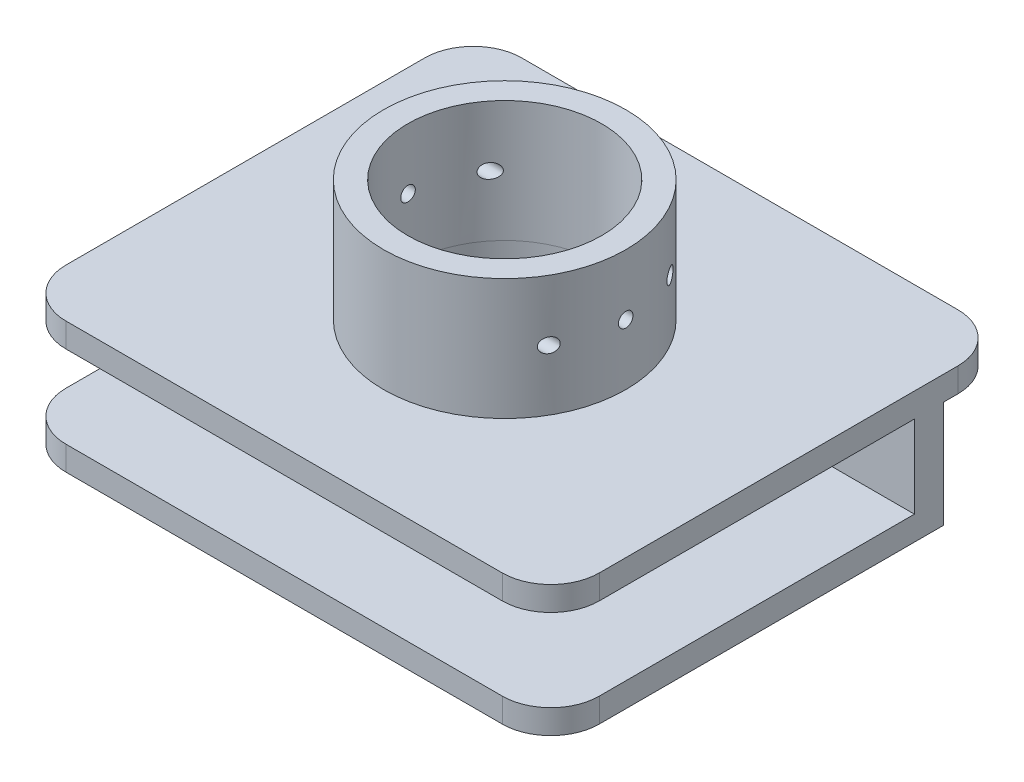
from build123d import *
from build123d.topology import SkipClean

# Parameters (mm, degrees)
IZIM1_W                          = 110
IZIM1_H                          = 5
Y_KSEKLIK_EKSTR_ZYON1_DEPTH      = 80
Y_KSEKLIK_EKSTR_ZYON1_2_DEPTH    = 80
Y_KSEKLIK_EKSTR_ZYON2_DEPTH      = 5
Y_KSEKLIK_EKSTR_ZYON2_DEPTH_BACK = 1
IZIM3_W                          = 110
IZIM3_H                          = 27
RADYUS1_R                        = 10
RADYUS2_R                        = 10
RADYUS3_R                        = 10
RADYUS4_R                        = 10
Y_KSEKLIK_EKSTR_ZYON3_DEPTH      = 25
IZIM5_R                          = 20
KES_EKSTR_ZYON1_DEPTH            = 14
KES_EKSTR_ZYON6_DEPTH            = 32
KES_EKSTR_ZYON7_DEPTH            = 47
KES_EKSTR_ZYON7_DEPTH_BACK       = 50
IZIM7_W                          = 110
IZIM7_H                          = 5
Y_KSEKLIK_EKSTR_ZYON4_DEPTH      = 13
RADYUS5_R                        = 10
RADYUS6_R                        = 10


with BuildPart() as part:
    # Çizim1 → Yükseklik-Ekstrüzyon1 (new body)
    with BuildSketch(Plane.XY):
        with Locations((-3.590869611, -4.330118179)):
            Rectangle(IZIM1_W, IZIM1_H)
    extrude(amount=Y_KSEKLIK_EKSTR_ZYON1_DEPTH)



with BuildPart() as body_2:
    # Çizim1 → Y_kseklik-Ekstr_zyon1 2 (new body)
    with BuildSketch(Plane.XY):
        with Locations((-3.590869611, -26.330118179)):
            Rectangle(IZIM1_W, IZIM1_H)
    extrude(amount=Y_KSEKLIK_EKSTR_ZYON1_2_DEPTH)


with BuildPart() as part_1:
    add(part.part)

    add(body_2.part)  # Yükseklik-Ekstrüzyon2 merges body 2
    # Çizim3 → Yükseklik-Ekstrüzyon2 (add, two sides: drawn at the far end of the back side and taken through both)
    with BuildSketch(Plane.XY.offset(-Y_KSEKLIK_EKSTR_ZYON2_DEPTH_BACK)):
        with Locations((-3.590869611, -15.330118179)):
            Rectangle(IZIM3_W, IZIM3_H)
    extrude(amount=Y_KSEKLIK_EKSTR_ZYON2_DEPTH + Y_KSEKLIK_EKSTR_ZYON2_DEPTH_BACK)

    # Radyus1
    radyus1_edges = [part_1.edges().sort_by_distance(p)[0] for p in [
        (-58.590869611, -4.330118179, 80),
    ]]
    fillet(radyus1_edges, radius=RADYUS1_R)

    # Radyus2
    radyus2_edges = [part_1.edges().sort_by_distance(p)[0] for p in [
        (-58.590869611, -26.330118179, 80),
    ]]
    fillet(radyus2_edges, radius=RADYUS2_R)

    # Radyus3
    radyus3_edges = [part_1.edges().sort_by_distance(p)[0] for p in [
        (51.409130389, -4.330118179, 80),
    ]]
    fillet(radyus3_edges, radius=RADYUS3_R)

    # Radyus4
    radyus4_edges = [part_1.edges().sort_by_distance(p)[0] for p in [
        (51.409130389, -26.330118179, 80),
    ]]
    fillet(radyus4_edges, radius=RADYUS4_R)

    # Çizim4 → Yükseklik-Ekstrüzyon3 (add)
    with BuildSketch(Plane(origin=(0, -1.830118179, 0), x_dir=(1, 0, 0), z_dir=(0, 1, 0))):
        with BuildLine():
            ThreePointArc((17.413740105, -20.942479183), (-3.590869611, -9.5), (-24.595479326, -20.942479183))
            Line((-24.595479326, -20.942479183), (-20.394557383, -23.653983347))
            ThreePointArc((-20.394557383, -23.653983347), (-3.590869611, -14.5), (13.212818162, -23.653983347))
            Line((13.212818162, -23.653983347), (17.413740105, -20.942479183))
        make_face()
        with BuildLine():
            Line((-20.394557383, -23.653983347), (-24.595479326, -20.942479183))
            ThreePointArc((-24.595479326, -20.942479183), (-28.590869611, -34.5), (-24.595479326, -48.057520817))
            Line((-24.595479326, -48.057520817), (-20.394557383, -45.346016653))
            ThreePointArc((-20.394557383, -45.346016653), (-23.590869611, -34.5), (-20.394557383, -23.653983347))
        make_face()
        with BuildLine():
            Line((-20.394557383, -45.346016653), (-24.595479326, -48.057520817))
            ThreePointArc((-24.595479326, -48.057520817), (-3.590869611, -59.5), (17.413740105, -48.057520817))
            Line((17.413740105, -48.057520817), (13.212818162, -45.346016653))
            ThreePointArc((13.212818162, -45.346016653), (-3.590869611, -54.5), (-20.394557383, -45.346016653))
        make_face()
        with BuildLine():
            ThreePointArc((21.409130389, -34.5), (20.389489466, -27.433007814), (17.413740105, -20.942479183))
            Line((17.413740105, -20.942479183), (13.212818162, -23.653983347))
            ThreePointArc((13.212818162, -23.653983347), (15.593417651, -28.846406251), (16.409130389, -34.5))
            ThreePointArc((16.409130389, -34.5), (15.593417651, -40.153593749), (13.212818162, -45.346016653))
            Line((13.212818162, -45.346016653), (17.413740105, -48.057520817))
            ThreePointArc((17.413740105, -48.057520817), (20.389489466, -41.566992186), (21.409130389, -34.5))
        make_face()
        with BuildLine():
            ThreePointArc((17.413740105, -20.942479183), (-3.590869611, -9.5), (-24.595479326, -20.942479183))
            Line((-24.595479326, -20.942479183), (-20.394557383, -23.653983347))
            ThreePointArc((-20.394557383, -23.653983347), (-3.590869611, -14.5), (13.212818162, -23.653983347))
            Line((13.212818162, -23.653983347), (17.413740105, -20.942479183))
        make_face()
        with BuildLine():
            Line((-20.394557383, -23.653983347), (-24.595479326, -20.942479183))
            ThreePointArc((-24.595479326, -20.942479183), (-28.590869611, -34.5), (-24.595479326, -48.057520817))
            Line((-24.595479326, -48.057520817), (-20.394557383, -45.346016653))
            ThreePointArc((-20.394557383, -45.346016653), (-23.590869611, -34.5), (-20.394557383, -23.653983347))
        make_face()
        with BuildLine():
            Line((-20.394557383, -45.346016653), (-24.595479326, -48.057520817))
            ThreePointArc((-24.595479326, -48.057520817), (-3.590869611, -59.5), (17.413740105, -48.057520817))
            Line((17.413740105, -48.057520817), (13.212818162, -45.346016653))
            ThreePointArc((13.212818162, -45.346016653), (-3.590869611, -54.5), (-20.394557383, -45.346016653))
        make_face()
        with BuildLine():
            ThreePointArc((21.409130389, -34.5), (20.389489466, -27.433007814), (17.413740105, -20.942479183))
            Line((17.413740105, -20.942479183), (13.212818162, -23.653983347))
            ThreePointArc((13.212818162, -23.653983347), (15.593417651, -28.846406251), (16.409130389, -34.5))
            ThreePointArc((16.409130389, -34.5), (15.593417651, -40.153593749), (13.212818162, -45.346016653))
            Line((13.212818162, -45.346016653), (17.413740105, -48.057520817))
            ThreePointArc((17.413740105, -48.057520817), (20.389489466, -41.566992186), (21.409130389, -34.5))
        make_face()
        with BuildLine():
            ThreePointArc((17.413740105, -20.942479183), (-3.590869611, -9.5), (-24.595479326, -20.942479183))
            Line((-24.595479326, -20.942479183), (-20.394557383, -23.653983347))
            ThreePointArc((-20.394557383, -23.653983347), (-3.590869611, -14.5), (13.212818162, -23.653983347))
            Line((13.212818162, -23.653983347), (17.413740105, -20.942479183))
        make_face()
        with BuildLine():
            Line((-20.394557383, -23.653983347), (-24.595479326, -20.942479183))
            ThreePointArc((-24.595479326, -20.942479183), (-28.590869611, -34.5), (-24.595479326, -48.057520817))
            Line((-24.595479326, -48.057520817), (-20.394557383, -45.346016653))
            ThreePointArc((-20.394557383, -45.346016653), (-23.590869611, -34.5), (-20.394557383, -23.653983347))
        make_face()
        with BuildLine():
            Line((-20.394557383, -45.346016653), (-24.595479326, -48.057520817))
            ThreePointArc((-24.595479326, -48.057520817), (-3.590869611, -59.5), (17.413740105, -48.057520817))
            Line((17.413740105, -48.057520817), (13.212818162, -45.346016653))
            ThreePointArc((13.212818162, -45.346016653), (-3.590869611, -54.5), (-20.394557383, -45.346016653))
        make_face()
        with BuildLine():
            ThreePointArc((21.409130389, -34.5), (20.389489466, -27.433007814), (17.413740105, -20.942479183))
            Line((17.413740105, -20.942479183), (13.212818162, -23.653983347))
            ThreePointArc((13.212818162, -23.653983347), (15.593417651, -28.846406251), (16.409130389, -34.5))
            ThreePointArc((16.409130389, -34.5), (15.593417651, -40.153593749), (13.212818162, -45.346016653))
            Line((13.212818162, -45.346016653), (17.413740105, -48.057520817))
            ThreePointArc((17.413740105, -48.057520817), (20.389489466, -41.566992186), (21.409130389, -34.5))
        make_face()
        with BuildLine():
            ThreePointArc((17.413740105, -20.942479183), (-3.590869611, -9.5), (-24.595479326, -20.942479183))
            Line((-24.595479326, -20.942479183), (-20.394557383, -23.653983347))
            ThreePointArc((-20.394557383, -23.653983347), (-3.590869611, -14.5), (13.212818162, -23.653983347))
            Line((13.212818162, -23.653983347), (17.413740105, -20.942479183))
        make_face()
        with BuildLine():
            Line((-20.394557383, -23.653983347), (-24.595479326, -20.942479183))
            ThreePointArc((-24.595479326, -20.942479183), (-28.590869611, -34.5), (-24.595479326, -48.057520817))
            Line((-24.595479326, -48.057520817), (-20.394557383, -45.346016653))
            ThreePointArc((-20.394557383, -45.346016653), (-23.590869611, -34.5), (-20.394557383, -23.653983347))
        make_face()
        with BuildLine():
            Line((-20.394557383, -45.346016653), (-24.595479326, -48.057520817))
            ThreePointArc((-24.595479326, -48.057520817), (-3.590869611, -59.5), (17.413740105, -48.057520817))
            Line((17.413740105, -48.057520817), (13.212818162, -45.346016653))
            ThreePointArc((13.212818162, -45.346016653), (-3.590869611, -54.5), (-20.394557383, -45.346016653))
        make_face()
        with BuildLine():
            ThreePointArc((21.409130389, -34.5), (20.389489466, -27.433007814), (17.413740105, -20.942479183))
            Line((17.413740105, -20.942479183), (13.212818162, -23.653983347))
            ThreePointArc((13.212818162, -23.653983347), (15.593417651, -28.846406251), (16.409130389, -34.5))
            ThreePointArc((16.409130389, -34.5), (15.593417651, -40.153593749), (13.212818162, -45.346016653))
            Line((13.212818162, -45.346016653), (17.413740105, -48.057520817))
            ThreePointArc((17.413740105, -48.057520817), (20.389489466, -41.566992186), (21.409130389, -34.5))
        make_face()
    extrude(amount=Y_KSEKLIK_EKSTR_ZYON3_DEPTH)

    # Çizim5 → Kes-Ekstrüzyon1 (cut)
    with BuildSketch(Plane(origin=(0, -1.830118179, 0), x_dir=(1, 0, 0), z_dir=(0, 1, 0))):
        with Locations(Location((-3.63539707, -34.290982672, 0), (0, 0, 192.332196637))):
            Circle(IZIM5_R)
    extrude(amount=-KES_EKSTR_ZYON1_DEPTH, mode=Mode.SUBTRACT)

    # Çizim6 → Kes-Ekstrüzyon6 (cut)
    with BuildSketch(Plane(origin=(0, 0, 0), x_dir=(0, 0, -1), z_dir=(1, 0, 0))):
        with BuildLine():
            Line((-34.5, 10.669881821), (-35.841640786, 11.340702215))
            ThreePointArc((-35.841640786, 11.340702215), (-35.959873484, 11.014511202), (-36, 10.669881821))
            Line((-36, 10.669881821), (-34.5, 10.669881821))
        make_face()
        with BuildLine():
            Line((-33.158359214, 9.999061428), (-34.5, 10.669881821))
            Line((-34.5, 10.669881821), (-36, 10.669881821))
            ThreePointArc((-36, 10.669881821), (-34.844629381, 9.210008337), (-33.158359214, 9.999061428))
        make_face()
        with BuildLine():
            ThreePointArc((-33, 10.669881821), (-34.155370619, 12.129755306), (-35.841640786, 11.340702215))
            Line((-35.841640786, 11.340702215), (-34.5, 10.669881821))
            Line((-34.5, 10.669881821), (-33, 10.669881821))
        make_face()
        with BuildLine():
            Line((-34.5, 10.669881821), (-35.841640786, 11.340702215))
            ThreePointArc((-35.841640786, 11.340702215), (-35.959873484, 11.014511202), (-36, 10.669881821))
            Line((-36, 10.669881821), (-34.5, 10.669881821))
        make_face()
        with BuildLine():
            Line((-33, 10.669881821), (-34.5, 10.669881821))
            Line((-34.5, 10.669881821), (-33.158359214, 9.999061428))
            ThreePointArc((-33.158359214, 9.999061428), (-33.040126516, 10.325252441), (-33, 10.669881821))
        make_face()
        with BuildLine():
            Line((-33.158359214, 9.999061428), (-34.5, 10.669881821))
            Line((-34.5, 10.669881821), (-36, 10.669881821))
            ThreePointArc((-36, 10.669881821), (-34.844629381, 9.210008337), (-33.158359214, 9.999061428))
        make_face()
        with BuildLine():
            Line((-34.5, 10.669881821), (-35.841640786, 11.340702215))
            ThreePointArc((-35.841640786, 11.340702215), (-35.959873484, 11.014511202), (-36, 10.669881821))
            Line((-36, 10.669881821), (-34.5, 10.669881821))
        make_face()
        with BuildLine():
            Line((-33.158359214, 9.999061428), (-34.5, 10.669881821))
            Line((-34.5, 10.669881821), (-36, 10.669881821))
            ThreePointArc((-36, 10.669881821), (-34.844629381, 9.210008337), (-33.158359214, 9.999061428))
        make_face()
        with BuildLine():
            ThreePointArc((-33, 10.669881821), (-34.155370619, 12.129755306), (-35.841640786, 11.340702215))
            Line((-35.841640786, 11.340702215), (-34.5, 10.669881821))
            Line((-34.5, 10.669881821), (-33, 10.669881821))
        make_face()
        with BuildLine():
            Line((-34.5, 10.669881821), (-35.841640786, 11.340702215))
            ThreePointArc((-35.841640786, 11.340702215), (-35.959873484, 11.014511202), (-36, 10.669881821))
            Line((-36, 10.669881821), (-34.5, 10.669881821))
        make_face()
        with BuildLine():
            Line((-33, 10.669881821), (-34.5, 10.669881821))
            Line((-34.5, 10.669881821), (-33.158359214, 9.999061428))
            ThreePointArc((-33.158359214, 9.999061428), (-33.040126516, 10.325252441), (-33, 10.669881821))
        make_face()
        with BuildLine():
            Line((-33.158359214, 9.999061428), (-34.5, 10.669881821))
            Line((-34.5, 10.669881821), (-36, 10.669881821))
            ThreePointArc((-36, 10.669881821), (-34.844629381, 9.210008337), (-33.158359214, 9.999061428))
        make_face()
    extrude(amount=-KES_EKSTR_ZYON6_DEPTH, mode=Mode.SUBTRACT)

    # Çizim6<4> → Kes-Ekstrüzyon7 (cut, two sides: drawn at the far end of the back side and taken through both)
    with SkipClean():  # the faces are left unmerged after this step: merging them gives an invalid solid
        with BuildSketch(Plane(origin=(0, 0, 0), x_dir=(0, 0, -1), z_dir=(1, 0, 0)).offset(-KES_EKSTR_ZYON7_DEPTH_BACK)):
            with BuildLine():
                ThreePointArc((-45.5, 10.669881821), (-47, 12.169881821), (-48.5, 10.669881821))
                Line((-48.5, 10.669881821), (-45.5, 10.669881821))
            make_face()
            with BuildLine():
                Line((-45.5, 10.669881821), (-48.5, 10.669881821))
                ThreePointArc((-48.5, 10.669881821), (-47, 9.169881821), (-45.5, 10.669881821))
            make_face()
            with BuildLine():
                ThreePointArc((-45.5, 10.669881821), (-47, 12.169881821), (-48.5, 10.669881821))
                Line((-48.5, 10.669881821), (-45.5, 10.669881821))
            make_face()
            with BuildLine():
                Line((-45.5, 10.669881821), (-48.5, 10.669881821))
                ThreePointArc((-48.5, 10.669881821), (-47, 9.169881821), (-45.5, 10.669881821))
            make_face()
            with BuildLine():
                ThreePointArc((-23.5, 10.669881821), (-22, 9.169881821), (-20.5, 10.669881821))
                Line((-20.5, 10.669881821), (-22, 10.669881821))
                Line((-22, 10.669881821), (-23.5, 10.669881821))
            make_face()
            with BuildLine():
                Line((-22, 10.669881821), (-20.5, 10.669881821))
                ThreePointArc((-20.5, 10.669881821), (-22, 12.169881821), (-23.5, 10.669881821))
                Line((-23.5, 10.669881821), (-22, 10.669881821))
            make_face()
            with BuildLine():
                Line((-34.5, 10.669881821), (-35.841640786, 11.340702215))
                ThreePointArc((-35.841640786, 11.340702215), (-35.959873484, 11.014511202), (-36, 10.669881821))
                Line((-36, 10.669881821), (-34.5, 10.669881821))
            make_face()
            with BuildLine():
                Line((-33.158359214, 9.999061428), (-34.5, 10.669881821))
                Line((-34.5, 10.669881821), (-36, 10.669881821))
                ThreePointArc((-36, 10.669881821), (-34.844629381, 9.210008337), (-33.158359214, 9.999061428))
            make_face()
            with BuildLine():
                ThreePointArc((-33, 10.669881821), (-34.155370619, 12.129755306), (-35.841640786, 11.340702215))
                Line((-35.841640786, 11.340702215), (-34.5, 10.669881821))
                Line((-34.5, 10.669881821), (-33, 10.669881821))
            make_face()
            with BuildLine():
                Line((-34.5, 10.669881821), (-35.841640786, 11.340702215))
                ThreePointArc((-35.841640786, 11.340702215), (-35.959873484, 11.014511202), (-36, 10.669881821))
                Line((-36, 10.669881821), (-34.5, 10.669881821))
            make_face()
            with BuildLine():
                Line((-33, 10.669881821), (-34.5, 10.669881821))
                Line((-34.5, 10.669881821), (-33.158359214, 9.999061428))
                ThreePointArc((-33.158359214, 9.999061428), (-33.040126516, 10.325252441), (-33, 10.669881821))
            make_face()
            with BuildLine():
                Line((-33.158359214, 9.999061428), (-34.5, 10.669881821))
                Line((-34.5, 10.669881821), (-36, 10.669881821))
                ThreePointArc((-36, 10.669881821), (-34.844629381, 9.210008337), (-33.158359214, 9.999061428))
            make_face()
            with BuildLine():
                ThreePointArc((-33, 10.669881821), (-34.155370619, 12.129755306), (-35.841640786, 11.340702215))
                Line((-35.841640786, 11.340702215), (-34.5, 10.669881821))
                Line((-34.5, 10.669881821), (-33, 10.669881821))
            make_face()
            with BuildLine():
                Line((-34.5, 10.669881821), (-35.841640786, 11.340702215))
                ThreePointArc((-35.841640786, 11.340702215), (-35.959873484, 11.014511202), (-36, 10.669881821))
                Line((-36, 10.669881821), (-34.5, 10.669881821))
            make_face()
            with BuildLine():
                Line((-33, 10.669881821), (-34.5, 10.669881821))
                Line((-34.5, 10.669881821), (-33.158359214, 9.999061428))
                ThreePointArc((-33.158359214, 9.999061428), (-33.040126516, 10.325252441), (-33, 10.669881821))
            make_face()
            with BuildLine():
                Line((-33.158359214, 9.999061428), (-34.5, 10.669881821))
                Line((-34.5, 10.669881821), (-36, 10.669881821))
                ThreePointArc((-36, 10.669881821), (-34.844629381, 9.210008337), (-33.158359214, 9.999061428))
            make_face()
            with BuildLine():
                Line((-34.5, 10.669881821), (-35.841640786, 11.340702215))
                ThreePointArc((-35.841640786, 11.340702215), (-35.959873484, 11.014511202), (-36, 10.669881821))
                Line((-36, 10.669881821), (-34.5, 10.669881821))
            make_face()
            with BuildLine():
                Line((-33.158359214, 9.999061428), (-34.5, 10.669881821))
                Line((-34.5, 10.669881821), (-36, 10.669881821))
                ThreePointArc((-36, 10.669881821), (-34.844629381, 9.210008337), (-33.158359214, 9.999061428))
            make_face()
        extrude(amount=KES_EKSTR_ZYON7_DEPTH + KES_EKSTR_ZYON7_DEPTH_BACK, mode=Mode.SUBTRACT)

    # Çizim7 → Yükseklik-Ekstrüzyon4 (add)
    with SkipClean():  # the faces are left unmerged after this step: merging them gives an invalid solid
        with BuildSketch(Plane(origin=(0, 0, -1), x_dir=(-1, 0, 0), z_dir=(0, 0, -1))):
            with Locations((3.590869611, -4.330118179)):
                Rectangle(IZIM7_W, IZIM7_H)
        extrude(amount=Y_KSEKLIK_EKSTR_ZYON4_DEPTH)

    # Radyus5
    radyus5_edges = [part_1.edges().sort_by_distance(p)[0] for p in [
        (51.409130389, -4.330118179, -14),
    ]]
    fillet(radyus5_edges, radius=RADYUS5_R)

    # Radyus6
    radyus6_edges = [part_1.edges().sort_by_distance(p)[0] for p in [
        (-58.590869611, -4.330118179, -14),
    ]]
    fillet(radyus6_edges, radius=RADYUS6_R)


solid = part_1.part
